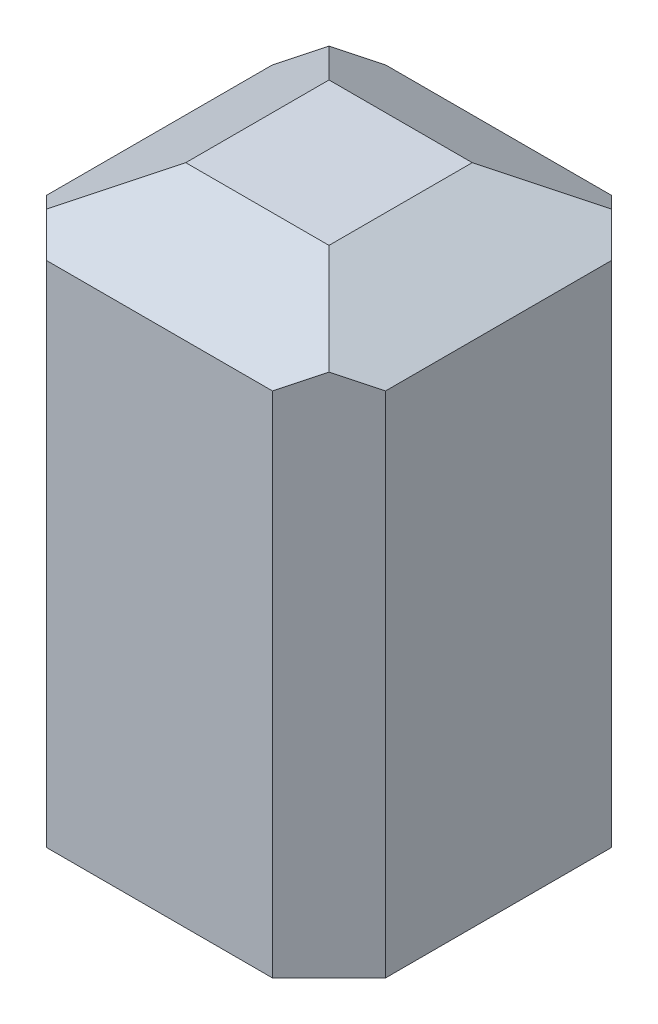
from build123d import *
from OCP.BRepFilletAPI import BRepFilletAPI_MakeChamfer

# Parameters (mm, degrees)
SKETCH11_W     = 6
SKETCH11_H     = 6
EXTRUDE8_DEPTH = 10
CHAMFER1_SIZE  = 1
CHAMFER2_SIZE  = 1
CHAMFER3_SIZE  = 1
CHAMFER3_SIZE2 = 1.732050808
CHAMFER4_SIZE  = 1
CHAMFER4_SIZE2 = 1.732050808


with BuildPart() as part:
    # Sketch11 → Extrude8 (new body)
    with BuildSketch(Plane(origin=(0, 0, 0), x_dir=(1, 0, 0), z_dir=(0, 1, 0))):
        Rectangle(SKETCH11_W, SKETCH11_H)
    extrude(amount=EXTRUDE8_DEPTH)

    # Chamfer1
    chamfer1_edges = [part.edges().sort_by_distance(p)[0] for p in [
        (3, 5, -3),
        (-3, 5, 3),
    ]]
    chamfer(chamfer1_edges, length=CHAMFER1_SIZE)

    # Chamfer2
    chamfer2_edges = [part.edges().sort_by_distance(p)[0] for p in [
        (-3, 5, -3),
        (3, 5, 3),
    ]]
    chamfer(chamfer2_edges, length=CHAMFER2_SIZE)

    # Chamfer3: one chamfer whose edges measure the first distance from different faces: ONE call of the kernel's chamfer builder (chamfer() names one face for all edges)
    chamfer3_edges_1 = [part.edges().sort_by_distance(p)[0] for p in [
        (0, 10, 3),
    ]]
    chamfer3_side_1 = [part.faces().sort_by_distance(p)[0] for p in [
        (0, 5, 3),
    ]]
    chamfer3_edges_2 = [part.edges().sort_by_distance(p)[0] for p in [
        (0, 10, -3),
    ]]
    chamfer3_side_2 = [part.faces().sort_by_distance(p)[0] for p in [
        (0, 5, -3),
    ]]
    chamfer3 = BRepFilletAPI_MakeChamfer(part.part.solid().wrapped)
    for e in chamfer3_edges_1:
        chamfer3.Add(CHAMFER3_SIZE, CHAMFER3_SIZE2, e.wrapped, chamfer3_side_1[0].wrapped)  # the first distance lies on this face
    for e in chamfer3_edges_2:
        chamfer3.Add(CHAMFER3_SIZE, CHAMFER3_SIZE2, e.wrapped, chamfer3_side_2[0].wrapped)  # the first distance lies on this face
    add(Compound.cast(chamfer3.Shape()), mode=Mode.REPLACE)

    # Chamfer4: one chamfer whose edges measure the first distance from different faces: ONE call of the kernel's chamfer builder (chamfer() names one face for all edges)
    chamfer4_edges_1 = [part.edges().sort_by_distance(p)[0] for p in [
        (3, 10, 0),
    ]]
    chamfer4_side_1 = [part.faces().sort_by_distance(p)[0] for p in [
        (3, 4.962121611, 0),
    ]]
    chamfer4_edges_2 = [part.edges().sort_by_distance(p)[0] for p in [
        (-3, 10, 0),
    ]]
    chamfer4_side_2 = [part.faces().sort_by_distance(p)[0] for p in [
        (-3, 4.962121611, 0),
    ]]
    chamfer4 = BRepFilletAPI_MakeChamfer(part.part.solid().wrapped)
    for e in chamfer4_edges_1:
        chamfer4.Add(CHAMFER4_SIZE, CHAMFER4_SIZE2, e.wrapped, chamfer4_side_1[0].wrapped)  # the first distance lies on this face
    for e in chamfer4_edges_2:
        chamfer4.Add(CHAMFER4_SIZE, CHAMFER4_SIZE2, e.wrapped, chamfer4_side_2[0].wrapped)  # the first distance lies on this face
    add(Compound.cast(chamfer4.Shape()), mode=Mode.REPLACE)


solid = part.part
